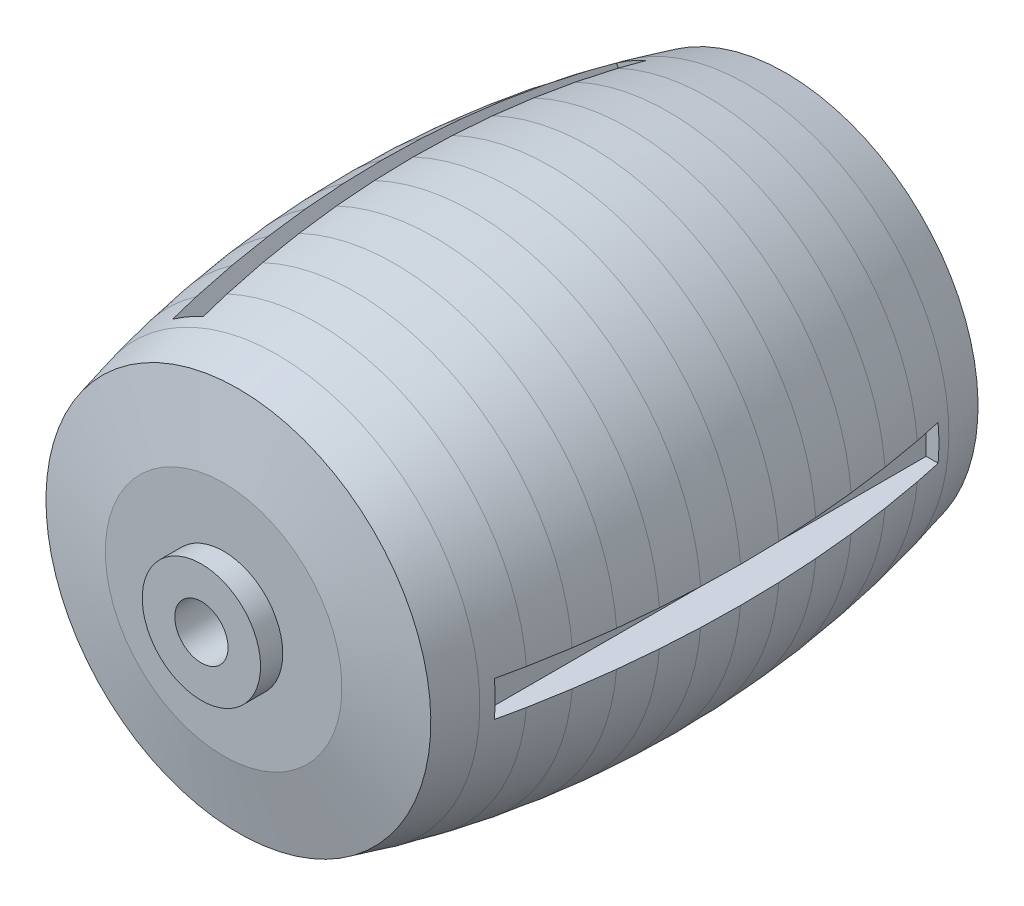
from build123d import *

# Parameters (mm, degrees)
F_0000_REVOLVE_ROTATE_ANGLE  = 90
F_0002_BOX_SKETCH_W          = 8
F_0002_BOX_SKETCH_H          = 2.4
F_0002_BOX_DEPTH             = 30
F_0004_BOX_SKETCH_W          = 8
F_0004_BOX_SKETCH_H          = 2.4
F_0004_BOX_DEPTH             = 30
F_0004_BOX_ROTATE_ANGLE      = 120
F_0006_BOX_SKETCH_W          = 8
F_0006_BOX_SKETCH_H          = 2.4
F_0006_BOX_DEPTH             = 30
F_0006_BOX_ROTATE_ANGLE      = 120
F_0011_CYLINDER_SKETCH_R     = 4
F_0011_CYLINDER_DEPTH        = 1.5
F_0011_CYLINDER_ROTATE_ANGLE = 180
F_0014_CYLINDER_SKETCH_R     = 4
F_0014_CYLINDER_DEPTH        = 1.5
F_0017_CYLINDER_SKETCH_R     = 1.8
F_0017_CYLINDER_DEPTH        = 44


with BuildPart() as part:
    # 0000_revolve_Sketch → 0000_revolve (revolve)
    with BuildSketch(Plane.XY, mode=Mode.PRIVATE) as f_0000_revolve_sk:
        Polygon((1.8, -19.5), (8, -19.5), (13.011110197, -18.5), (13.680283223, -15.857142857), (14.241418759, -13.214285714), (14.697145158, -10.571428571), (15.049534543, -7.928571429), (15.300152038, -5.285714286), (15.450091538, -2.642857143), (15.5, 0), (15.450091538, 2.642857143), (15.300152038, 5.285714286), (15.049534543, 7.928571429), (14.697145158, 10.571428571), (14.241418759, 13.214285714), (13.680283223, 15.857142857), (13.011110197, 18.5), (8, 19.5), (1.8, 19.5), align=None)
    revolve(f_0000_revolve_sk.sketch.rotate(Axis((0, -100, 0), (0, 1, 0)), 90), axis=Axis((0, -100, 0), (0, 1, 0)))


with BuildPart() as part_1:
    # 0000_revolve_Rotate: moved
    add(part.part.rotate(Axis((0, 0, 0), (1, 0, 0)), F_0000_REVOLVE_ROTATE_ANGLE))


with BuildPart() as body_2:
    # 0002_box_Sketch → 0002_box (new body)
    with BuildSketch(Plane.XY):
        with Locations((4, 1.2)):
            Rectangle(F_0002_BOX_SKETCH_W, F_0002_BOX_SKETCH_H)
    extrude(amount=F_0002_BOX_DEPTH)


with BuildPart() as body_2_1:
    # 0002_box_Translate: moved
    add(body_2.part.moved(Location((13, -1.2, -15))))


with BuildPart() as part_2:
    add(part_1.part)

    # 0008_sub: cut body 2
    add(body_2_1.part, mode=Mode.SUBTRACT)


with BuildPart() as body_2_2:
    # 0004_box_Sketch → 0004_box (new body)
    with BuildSketch(Plane.XY):
        with Locations((4, 1.2)):
            Rectangle(F_0004_BOX_SKETCH_W, F_0004_BOX_SKETCH_H)
    extrude(amount=F_0004_BOX_DEPTH)


with BuildPart() as body_2_2_1:
    # 0004_box_Rotate: moved
    add(body_2_2.part.rotate(Axis((0, 0, 0), (0, 0, 1)), F_0004_BOX_ROTATE_ANGLE))


with BuildPart() as body_2_2_2:
    # 0004_box_Translate: moved
    add(body_2_2_1.part.moved(Location((-5.460769515, 11.858330249, -15))))


with BuildPart() as part_3:
    add(part_2.part)

    # 0009_sub: cut body 2 2
    add(body_2_2_2.part, mode=Mode.SUBTRACT)


with BuildPart() as body_2_3:
    # 0006_box_Sketch → 0006_box (new body)
    with BuildSketch(Plane.XY):
        with Locations((4, 1.2)):
            Rectangle(F_0006_BOX_SKETCH_W, F_0006_BOX_SKETCH_H)
    extrude(amount=F_0006_BOX_DEPTH)


with BuildPart() as body_2_3_1:
    # 0006_box_Rotate: moved
    add(body_2_3.part.rotate(Axis((0, 0, 0), (0, 0, -1)), F_0006_BOX_ROTATE_ANGLE))


with BuildPart() as body_2_3_2:
    # 0006_box_Translate: moved
    add(body_2_3_1.part.moved(Location((-7.539230485, -10.658330249, -15))))


with BuildPart() as part_4:
    add(part_3.part)

    # 0010_sub: cut body 2 3
    add(body_2_3_2.part, mode=Mode.SUBTRACT)


with BuildPart() as body_2_4:
    # 0011_cylinder_Sketch → 0011_cylinder (new body)
    with BuildSketch(Plane.XY):
        Circle(F_0011_CYLINDER_SKETCH_R)
    extrude(amount=F_0011_CYLINDER_DEPTH)


with BuildPart() as body_2_4_1:
    # 0011_cylinder_Rotate: moved
    add(body_2_4.part.rotate(Axis((0, 0, 0), (1, 0, 0)), F_0011_CYLINDER_ROTATE_ANGLE))


with BuildPart() as body_2_4_2:
    # 0011_cylinder_Translate: moved
    add(body_2_4_1.part.moved(Location((0, 0, -19.5))))


with BuildPart() as part_5:
    add(part_4.part)

    # 0013_add: union body 2 4
    add(body_2_4_2.part)


with BuildPart() as body_2_5:
    # 0014_cylinder_Sketch → 0014_cylinder (new body)
    with BuildSketch(Plane.XY):
        Circle(F_0014_CYLINDER_SKETCH_R)
    extrude(amount=F_0014_CYLINDER_DEPTH)


with BuildPart() as body_2_5_1:
    # 0014_cylinder_Translate: moved
    add(body_2_5.part.moved(Location((0, 0, 19.5))))


with BuildPart() as part_6:
    add(part_5.part)

    # 0016_add: union body 2 5
    add(body_2_5_1.part)


with BuildPart() as body_2_6:
    # 0017_cylinder_Sketch → 0017_cylinder (new body)
    with BuildSketch(Plane.XY):
        with Locations(Location((0, 0, 0), (0, 0, 90))):
            Circle(F_0017_CYLINDER_SKETCH_R)
    extrude(amount=F_0017_CYLINDER_DEPTH)


with BuildPart() as body_2_6_1:
    # 0017_cylinder_Translate: moved
    add(body_2_6.part.moved(Location((0, 0, -22))))


with BuildPart() as part_7:
    add(part_6.part)

    # 0018_sub: cut body 2 6
    add(body_2_6_1.part, mode=Mode.SUBTRACT)


solid = part_7.part
